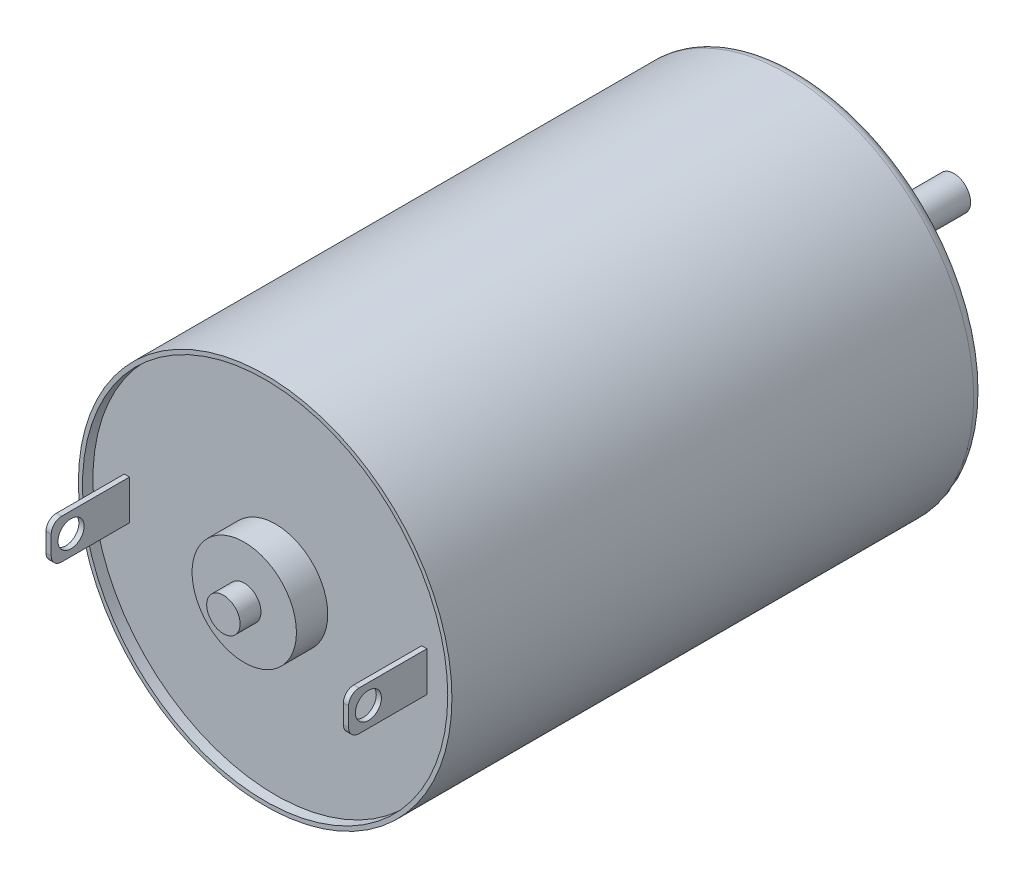
from build123d import *

# Parameters (mm, degrees)
SKETCH1_R                    = 17.9
BOSS_EXTRUDE1_DEPTH          = 50
SKETCH2_R                    = 6.5
BOSS_EXTRUDE2_DEPTH          = 4
SKETCH4_R                    = 5
BOSS_EXTRUDE3_DEPTH          = 3
BOSS_EXTRUDE4_DEPTH          = 11
BOSS_EXTRUDE4_DEPTH_BACK     = 59
SKETCH3_R                    = 1.6
SKETCH5_R                    = 17.9
SKETCH5_R_2                  = 17.5
BOSS_EXTRUDE5_DEPTH          = 1
SKETCH6_W                    = 0.5
SKETCH6_H                    = 3.8
BOSS_EXTRUDE6_DEPTH          = 7.5
SKETCH7_R                    = 1.25
CUT_EXTRUDE1_DEPTH           = 0.5
FILLET1_R                    = 1
FILLET1_OF_MIRROR3_R         = 1
FILLET2_R                    = 1
FILLET3_R                    = 1
M2_5X0_45_TAPPED_HOLE1_D     = 2.05
M2_5X0_45_TAPPED_HOLE1_DEPTH = 6.35
M2_5X0_45_TAPPED_HOLE1_TIP   = 0.615882135


with BuildPart() as part:
    # Sketch1 → Boss-Extrude1 (new body)
    with BuildSketch(Plane.XY):
        Circle(SKETCH1_R)
    extrude(amount=BOSS_EXTRUDE1_DEPTH)

    # Sketch2 → Boss-Extrude2 (add)
    with BuildSketch(Plane(origin=(0, 0, 0), x_dir=(-1, 0, 0), z_dir=(0, 0, -1))):
        Circle(SKETCH2_R)
    extrude(amount=BOSS_EXTRUDE2_DEPTH)

    # Sketch4 → Boss-Extrude3 (add)
    with BuildSketch(Plane.XY.offset(50)):
        Circle(SKETCH4_R)
    extrude(amount=BOSS_EXTRUDE3_DEPTH)

    # Sketch3 → Boss-Extrude4 (add, two sides: drawn at the far end of the back side and taken through both)
    with BuildSketch(Plane(origin=(0, 0, -4), x_dir=(-1, 0, 0), z_dir=(0, 0, -1)).offset(-BOSS_EXTRUDE4_DEPTH_BACK)):
        with Locations(Location((0, 0, 0), (0, 0, 180))):
            Circle(SKETCH3_R)
    extrude(amount=BOSS_EXTRUDE4_DEPTH + BOSS_EXTRUDE4_DEPTH_BACK)

    # Sketch5 → Boss-Extrude5 (add)
    with BuildSketch(Plane.XY.offset(50)):
        Circle(SKETCH5_R)
        Circle(SKETCH5_R_2, mode=Mode.SUBTRACT)
    extrude(amount=BOSS_EXTRUDE5_DEPTH)

    # Sketch6 → Boss-Extrude6 (add)
    with BuildSketch(Plane.XY.offset(50)):
        with Locations((-14.25, 0)):
            Rectangle(SKETCH6_W, SKETCH6_H)
    boss_extrude6 = extrude(amount=BOSS_EXTRUDE6_DEPTH)

    # Sketch7 → Cut-Extrude1 (cut)
    with BuildSketch(Plane.ZY.offset(14.5)):
        with Locations((55.6, 0)):
            Circle(SKETCH7_R)
    cut_extrude1 = extrude(amount=-CUT_EXTRUDE1_DEPTH, mode=Mode.SUBTRACT)

    # Fillet1
    fillet1_edges = [part.edges().sort_by_distance(p)[0] for p in [
        (-14.25, 1.9, 57.5),
        (-14.25, -1.9, 57.5),
    ]]
    fillet(fillet1_edges, radius=FILLET1_R)

    # Mirror3: Boss-Extrude6, Cut-Extrude1 across plane
    add(boss_extrude6.mirror(Plane(origin=(0, 0, 0), x_dir=(0, 0, 1), z_dir=(1, 0, 0))))
    add(cut_extrude1.mirror(Plane(origin=(0, 0, 0), x_dir=(0, 0, 1), z_dir=(1, 0, 0))), mode=Mode.SUBTRACT)

    # Fillet1 of Mirror3
    fillet1_of_mirror3_edges = [part.edges().sort_by_distance(p)[0] for p in [
        (14.25, 1.9, 57.5),
        (14.25, -1.9, 57.5),
    ]]
    fillet(fillet1_of_mirror3_edges, radius=FILLET1_OF_MIRROR3_R)

    # Fillet2
    fillet2_edges = [part.edges().sort_by_distance(p)[0] for p in [
        (-17.9, 0, 0),
    ]]
    fillet(fillet2_edges, radius=FILLET2_R)

    # Fillet3
    fillet3_edges = [part.edges().sort_by_distance(p)[0] for p in [
        (6.5, 0, -4),
    ]]
    fillet(fillet3_edges, radius=FILLET3_R)

    # M2.5x0.45 Tapped Hole1
    with Locations(Plane(origin=(0, 0, 0), x_dir=(-1, 0, 0), z_dir=(0, 0, -1))):
        with Locations((-12.5, 0), (12.5, 0)):
            Hole(M2_5X0_45_TAPPED_HOLE1_D / 2, depth=M2_5X0_45_TAPPED_HOLE1_DEPTH)
            with Locations((0, 0, -(M2_5X0_45_TAPPED_HOLE1_DEPTH + M2_5X0_45_TAPPED_HOLE1_TIP / 2))):  # 118° drill point
                Cone(0, M2_5X0_45_TAPPED_HOLE1_D / 2, M2_5X0_45_TAPPED_HOLE1_TIP, mode=Mode.SUBTRACT)


solid = part.part
